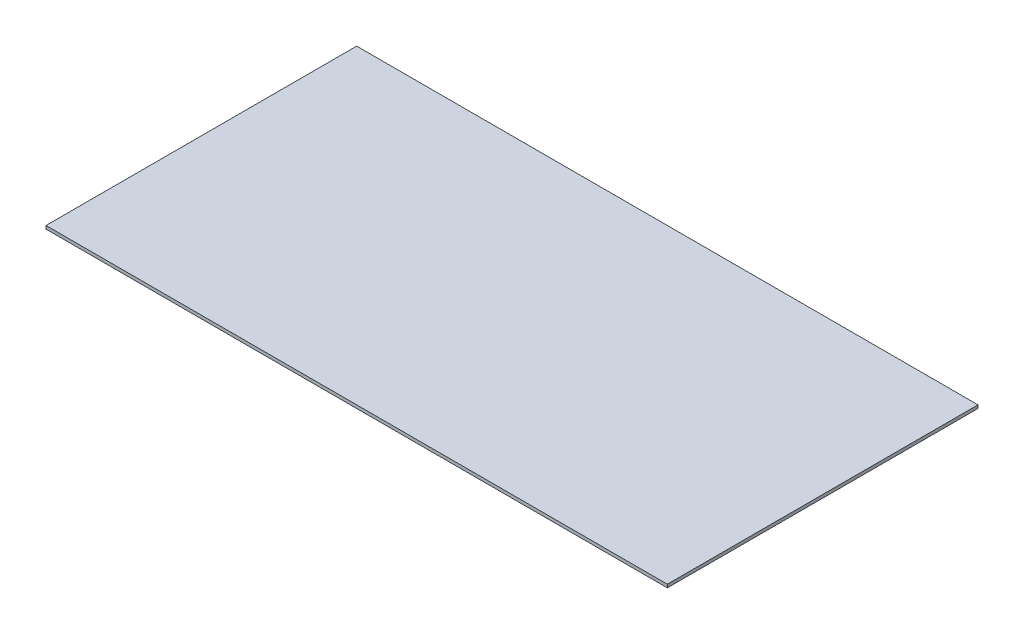
from build123d import *

# Parameters (mm, degrees)
SKETCH1_W           = 25.4
SKETCH1_H           = 12.7
BOSS_EXTRUDE1_DEPTH = 0.13


with BuildPart() as part:
    # Sketch1 → Boss-Extrude1 (new body)
    with BuildSketch(Plane(origin=(0, 0, 0), x_dir=(1, 0, 0), z_dir=(0, 1, 0))):
        with Locations((12.7, -6.35)):
            Rectangle(SKETCH1_W, SKETCH1_H)
    extrude(amount=BOSS_EXTRUDE1_DEPTH)


solid = part.part
